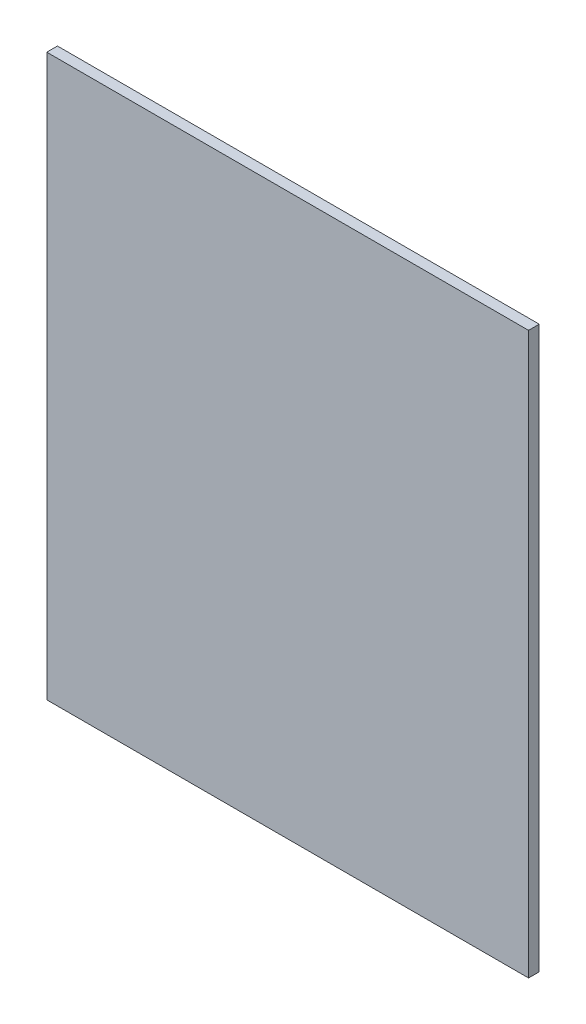
from build123d import *

# Parameters (mm, degrees)
SKETCH1_W           = 859
SKETCH1_H           = 1000
BOSS_EXTRUDE1_DEPTH = 19.05


with BuildPart() as part:
    # Sketch1 → Boss-Extrude1 (new body)
    with BuildSketch(Plane.XY):
        Rectangle(SKETCH1_W, SKETCH1_H)
    extrude(amount=BOSS_EXTRUDE1_DEPTH)


solid = part.part
